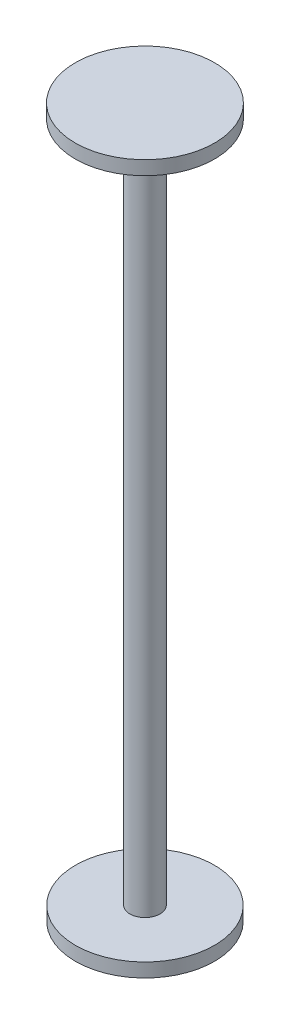
from build123d import *

# Parameters (mm, degrees)
SKETCH1_R           = 50
BOSS_EXTRUDE1_DEPTH = 10
SKETCH7_R           = 50.108210293
BOSS_EXTRUDE2_DEPTH = 10
SKETCH8_R           = 10.865455154
BOSS_EXTRUDE3_DEPTH = 500


with BuildPart() as part:
    # Sketch1 → Boss-Extrude1 (new body)
    with BuildSketch(Plane(origin=(0, 0, 0), x_dir=(1, 0, 0), z_dir=(0, 1, 0))):
        with Locations(Location((0, 0, 0), (0, 0, 270))):
            Circle(SKETCH1_R)
    extrude(amount=BOSS_EXTRUDE1_DEPTH)

    # Sketch8 → Boss-Extrude3 (add)
    with BuildSketch(Plane(origin=(0, 0, 0), x_dir=(1, 0, 0), z_dir=(0, 1, 0))):
        with Locations(Location((0, 0, 0), (0, 0, 270))):
            Circle(SKETCH8_R)
    extrude(amount=BOSS_EXTRUDE3_DEPTH)


with BuildPart() as body_2:
    # Sketch7 → Boss-Extrude2 (new body)
    with BuildSketch(Plane(origin=(0, 500, 0), x_dir=(1, 0, 0), z_dir=(0, 1, 0))):
        with Locations(Location((0, 0, 0), (0, 0, 270))):
            Circle(SKETCH7_R)
    extrude(amount=BOSS_EXTRUDE2_DEPTH)


solid = Compound([part.part, body_2.part])
